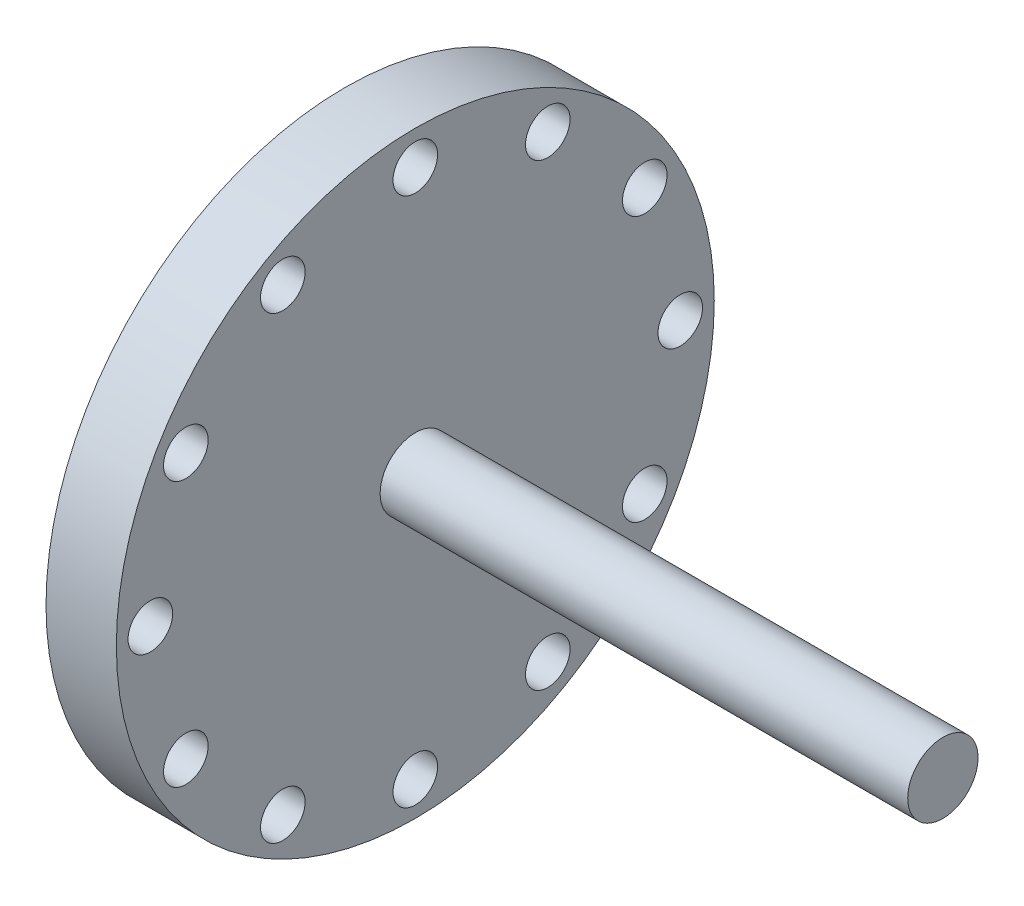
from build123d import *

# Parameters (mm, degrees)
SKETCH_2_R           = 9.5
CUT_EXTRUDE_1_DEPTH  = 321.526909947
SKETCH_3_R           = 9.5
CUT_EXTRUDE_2_DEPTH  = 321.526909947
SKETCH_4_R           = 9.5
CUT_EXTRUDE_3_DEPTH  = 321.526909947
SKETCH_5_R           = 9.5
CUT_EXTRUDE_4_DEPTH  = 321.526909947
SKETCH_6_R           = 9.5
CUT_EXTRUDE_5_DEPTH  = 321.526909947
SKETCH_7_R           = 9.5
CUT_EXTRUDE_6_DEPTH  = 321.526909947
SKETCH_8_R           = 9.5
CUT_EXTRUDE_7_DEPTH  = 321.526909947
SKETCH_9_R           = 9.5
CUT_EXTRUDE_8_DEPTH  = 321.526909947
SKETCH_10_R          = 9.5
CUT_EXTRUDE_9_DEPTH  = 321.526909947
SKETCH_11_R          = 9.5
CUT_EXTRUDE_10_DEPTH = 321.526909947
SKETCH_12_R          = 9.5
CUT_EXTRUDE_11_DEPTH = 321.526909947
SKETCH_13_R          = 9.5
CUT_EXTRUDE_12_DEPTH = 321.526909947


with BuildPart() as part:
    # Эскиз1 → Повернуть1 (revolve)
    with BuildSketch(Plane.XY, mode=Mode.PRIVATE) as revolve_1_sk:
        Polygon((0, 0), (265, 0), (265, 15), (40, 15), (40, 127.5), (10, 127.5), (10, 20), (0, 20), align=None)
    revolve(revolve_1_sk.sketch.rotate(Axis((0, 0, 0), (1, 0, 0)), 90), axis=Axis((0, 0, 0), (1, 0, 0)))

    # Эскиз2 → Вырез-Вытянуть1 (cut, through all)
    with BuildSketch(Plane(origin=(0, 0, 0), x_dir=(0, 0, -1), z_dir=(1, 0, 0))):
        with Locations(Location((0, 113, 0), (0, 0, 180))):
            Circle(SKETCH_2_R)
    extrude(amount=CUT_EXTRUDE_1_DEPTH, mode=Mode.SUBTRACT)

    # Эскиз3 → Вырез-Вытянуть2 (cut, through all)
    with BuildSketch(Plane(origin=(0, 0, 0), x_dir=(0, 0, -1), z_dir=(1, 0, 0))):
        with Locations(Location((-56.5, 97.860870628, 0), (0, 0, 180))):
            Circle(SKETCH_3_R)
    extrude(amount=CUT_EXTRUDE_2_DEPTH, mode=Mode.SUBTRACT)

    # Эскиз4 → Вырез-Вытянуть3 (cut, through all)
    with BuildSketch(Plane(origin=(0, 0, 0), x_dir=(0, 0, -1), z_dir=(1, 0, 0))):
        with Locations(Location((-97.860870628, 56.5, 0), (0, 0, 180))):
            Circle(SKETCH_4_R)
    extrude(amount=CUT_EXTRUDE_3_DEPTH, mode=Mode.SUBTRACT)

    # Эскиз5 → Вырез-Вытянуть4 (cut, through all)
    with BuildSketch(Plane(origin=(0, 0, 0), x_dir=(0, 0, -1), z_dir=(1, 0, 0))):
        with Locations(Location((-113, 0, 0), (0, 0, 180))):
            Circle(SKETCH_5_R)
    extrude(amount=CUT_EXTRUDE_4_DEPTH, mode=Mode.SUBTRACT)

    # Эскиз6 → Вырез-Вытянуть5 (cut, through all)
    with BuildSketch(Plane(origin=(0, 0, 0), x_dir=(0, 0, -1), z_dir=(1, 0, 0))):
        with Locations(Location((-97.860870628, -56.5, 0), (0, 0, 180))):
            Circle(SKETCH_6_R)
    extrude(amount=CUT_EXTRUDE_5_DEPTH, mode=Mode.SUBTRACT)

    # Эскиз7 → Вырез-Вытянуть6 (cut, through all)
    with BuildSketch(Plane(origin=(0, 0, 0), x_dir=(0, 0, -1), z_dir=(1, 0, 0))):
        with Locations(Location((-56.5, -97.860870628, 0), (0, 0, 180))):
            Circle(SKETCH_7_R)
    extrude(amount=CUT_EXTRUDE_6_DEPTH, mode=Mode.SUBTRACT)

    # Эскиз8 → Вырез-Вытянуть7 (cut, through all)
    with BuildSketch(Plane(origin=(0, 0, 0), x_dir=(0, 0, -1), z_dir=(1, 0, 0))):
        with Locations(Location((0, -113, 0), (0, 0, 180))):
            Circle(SKETCH_8_R)
    extrude(amount=CUT_EXTRUDE_7_DEPTH, mode=Mode.SUBTRACT)

    # Эскиз9 → Вырез-Вытянуть8 (cut, through all)
    with BuildSketch(Plane(origin=(0, 0, 0), x_dir=(0, 0, -1), z_dir=(1, 0, 0))):
        with Locations(Location((56.5, -97.860870628, 0), (0, 0, 180))):
            Circle(SKETCH_9_R)
    extrude(amount=CUT_EXTRUDE_8_DEPTH, mode=Mode.SUBTRACT)

    # Эскиз10 → Вырез-Вытянуть9 (cut, through all)
    with BuildSketch(Plane(origin=(0, 0, 0), x_dir=(0, 0, -1), z_dir=(1, 0, 0))):
        with Locations(Location((97.860870628, -56.5, 0), (0, 0, 180))):
            Circle(SKETCH_10_R)
    extrude(amount=CUT_EXTRUDE_9_DEPTH, mode=Mode.SUBTRACT)

    # Эскиз11 → Вырез-Вытянуть10 (cut, through all)
    with BuildSketch(Plane(origin=(0, 0, 0), x_dir=(0, 0, -1), z_dir=(1, 0, 0))):
        with Locations(Location((113, 0, 0), (0, 0, 180))):
            Circle(SKETCH_11_R)
    extrude(amount=CUT_EXTRUDE_10_DEPTH, mode=Mode.SUBTRACT)

    # Эскиз12 → Вырез-Вытянуть11 (cut, through all)
    with BuildSketch(Plane(origin=(0, 0, 0), x_dir=(0, 0, -1), z_dir=(1, 0, 0))):
        with Locations(Location((97.860870628, 56.5, 0), (0, 0, 180))):
            Circle(SKETCH_12_R)
    extrude(amount=CUT_EXTRUDE_11_DEPTH, mode=Mode.SUBTRACT)

    # Эскиз13 → Вырез-Вытянуть12 (cut, through all)
    with BuildSketch(Plane(origin=(0, 0, 0), x_dir=(0, 0, -1), z_dir=(1, 0, 0))):
        with Locations(Location((56.5, 97.860870628, 0), (0, 0, 180))):
            Circle(SKETCH_13_R)
    extrude(amount=CUT_EXTRUDE_12_DEPTH, mode=Mode.SUBTRACT)


solid = part.part
